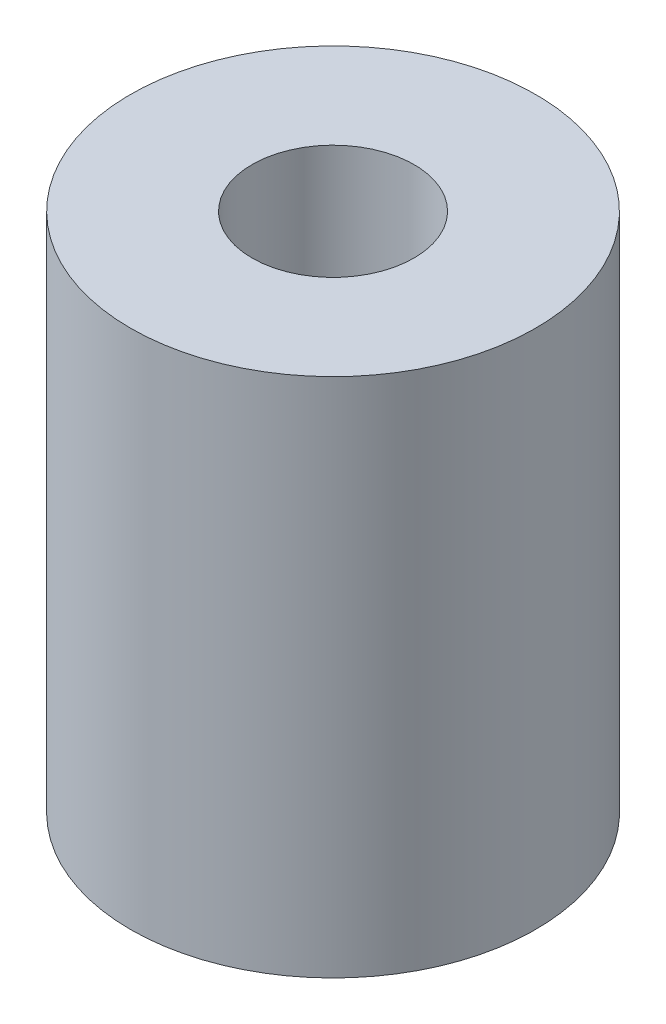
from build123d import *

# Parameters (mm, degrees)
CROQUIS1_R              = 3.5
SALIENTE_EXTRUIR1_DEPTH = 9
CROQUIS2_R              = 1.4
CORTAR_EXTRUIR1_DEPTH   = 11.271319292


with BuildPart() as part:
    # Croquis1 → Saliente-Extruir1 (new body)
    with BuildSketch(Plane(origin=(0, 0, 0), x_dir=(1, 0, 0), z_dir=(0, 1, 0))):
        with Locations(Location((0, 0, 0), (0, 0, 270))):
            Circle(CROQUIS1_R)
    extrude(amount=SALIENTE_EXTRUIR1_DEPTH)

    # Croquis2 → Cortar-Extruir1 (cut, through all)
    with BuildSketch(Plane(origin=(0, 9, 0), x_dir=(1, 0, 0), z_dir=(0, 1, 0))):
        with Locations(Location((0, 0, 0), (0, 0, 270))):
            Circle(CROQUIS2_R)
    extrude(amount=-CORTAR_EXTRUIR1_DEPTH, mode=Mode.SUBTRACT)


solid = part.part
